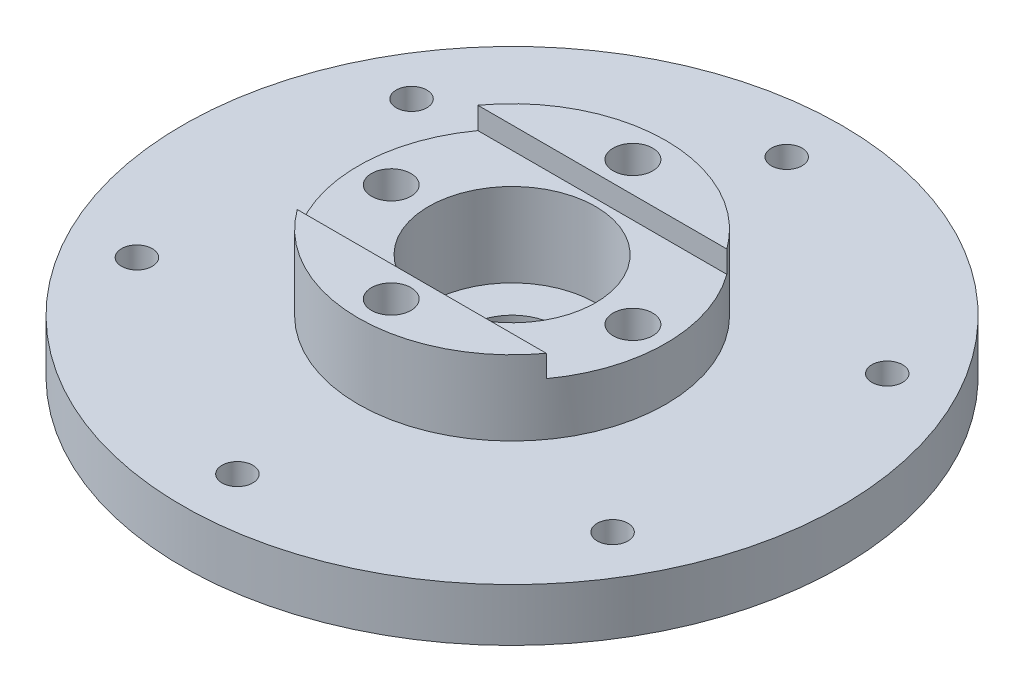
from build123d import *

# Parameters (mm, degrees)
SKETCH3_W         = 41.1
SKETCH3_H         = 5
EXTRUDE2_DEPTH    = 60
SKETCH2_R         = 4.5
EXTRUDE1_DEPTH    = 110.959083299
CIRPATTERN1_COUNT = 6


with BuildPart() as part:
    # Sketch1 → Revolve1 (revolve)
    with BuildSketch(Plane.XY, mode=Mode.PRIVATE) as revolve1_sk:
        Polygon((-10, 0), (-75, 0), (-75, 12), (-35, 12), (-35, 29), (-19, 29), (-19, 5), (-10, 5), align=None)
    revolve(revolve1_sk.sketch.rotate(Axis((0, 0, 0), (0, 1, 0)), 270), axis=Axis((0, 0, 0), (0, 1, 0)))

    # Sketch3 → Extrude2 (cut, symmetric)
    with BuildSketch(Plane(origin=(0, 0, 0), x_dir=(0, 0, -1), z_dir=(1, 0, 0))):
        with Locations((0, 26.5)):
            Rectangle(SKETCH3_W, SKETCH3_H)
    extrude(amount=EXTRUDE2_DEPTH, both=True, mode=Mode.SUBTRACT)

    # Sketch2 → Extrude1 (cut, through all)
    with BuildSketch(Plane.XZ):
        with Locations(Location((-27.5, 0, 0), (0, 0, 270))):
            Circle(SKETCH2_R)
        with Locations(Location((0, -27.5, 0), (0, 0, 270))):
            Circle(SKETCH2_R)
        with Locations(Location((0, 27.5, 0), (0, 0, 270))):
            Circle(SKETCH2_R)
        with Locations(Location((27.5, 0, 0), (0, 0, 270))):
            Circle(SKETCH2_R)
    extrude(amount=-EXTRUDE1_DEPTH, mode=Mode.SUBTRACT)

    # Sketch4 → M8x1.0 Tapped Hole1 (revolve, cut)
    with BuildSketch(Plane(origin=(0, 12, 62.5), x_dir=(0, 0, 1), z_dir=(1, 0, 0))):
        Polygon((0, 0), (0, 23.103012167), (3.5, 21), (3.5, 0), align=None)
    m8x1_0_tapped_hole1 = revolve(axis=Axis((0, 18.35, 62.5), (0, -1, 0)), mode=Mode.SUBTRACT)

    # CirPattern1: M8x1.0 Tapped Hole1 ×6 about axis
    cirpattern1_axis = Axis((0, 0, 0), (0, 1, 0))
    for i in range(1, CIRPATTERN1_COUNT):
        add(m8x1_0_tapped_hole1.rotate(cirpattern1_axis, i * 360 / CIRPATTERN1_COUNT), mode=Mode.SUBTRACT)


solid = part.part
